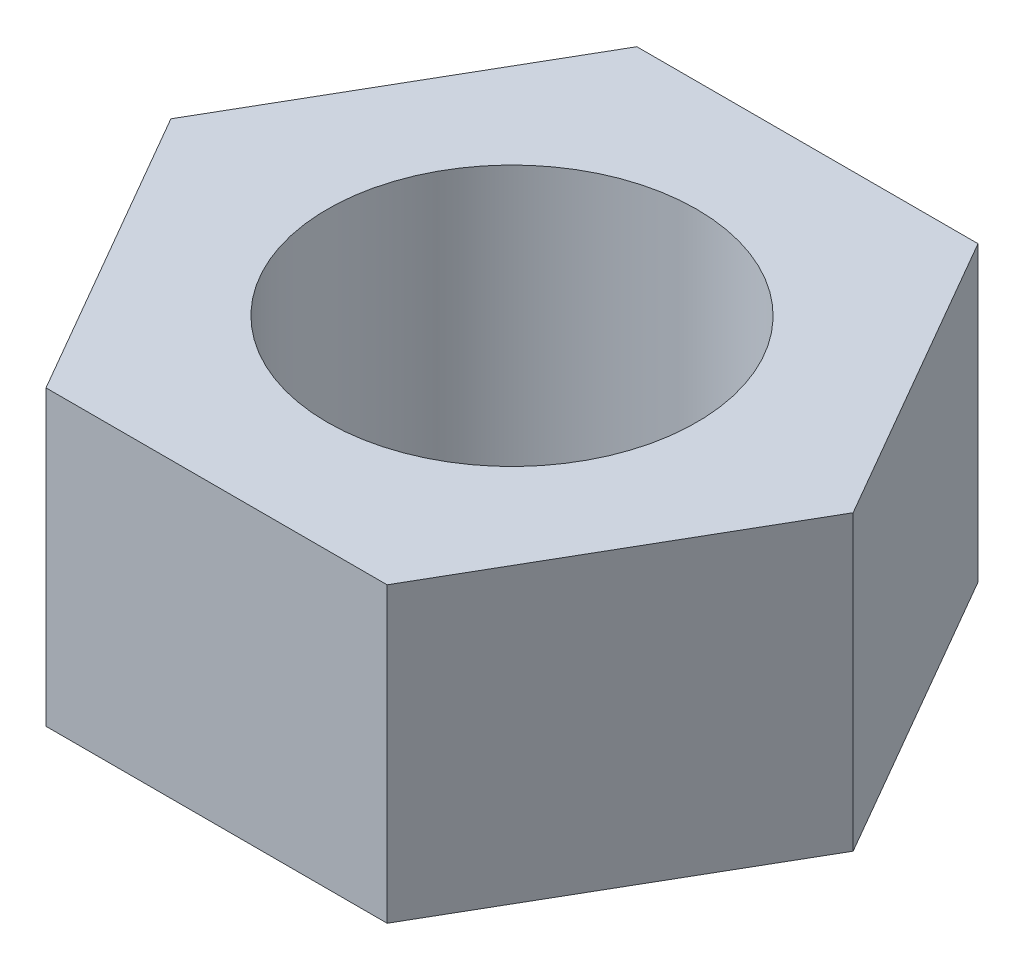
from build123d import *

# Parameters (mm, degrees)
ESQUISSE1_R        = 4
BOSS_EXTRU_1_DEPTH = 6.35


with BuildPart() as part:
    # Esquisse1 → Boss.-Extru.1 (new body)
    with BuildSketch(Plane(origin=(0, 0, 0), x_dir=(1, 0, 0), z_dir=(0, 1, 0))):
        Polygon((7.390083446, 0), (3.695041723, 6.4), (-3.695041723, 6.4), (-7.390083446, 0), (-3.695041723, -6.4), (3.695041723, -6.4), align=None)
        with Locations(Location((0, 0, 0), (0, 0, 270))):
            Circle(ESQUISSE1_R, mode=Mode.SUBTRACT)
    extrude(amount=BOSS_EXTRU_1_DEPTH)


solid = part.part
